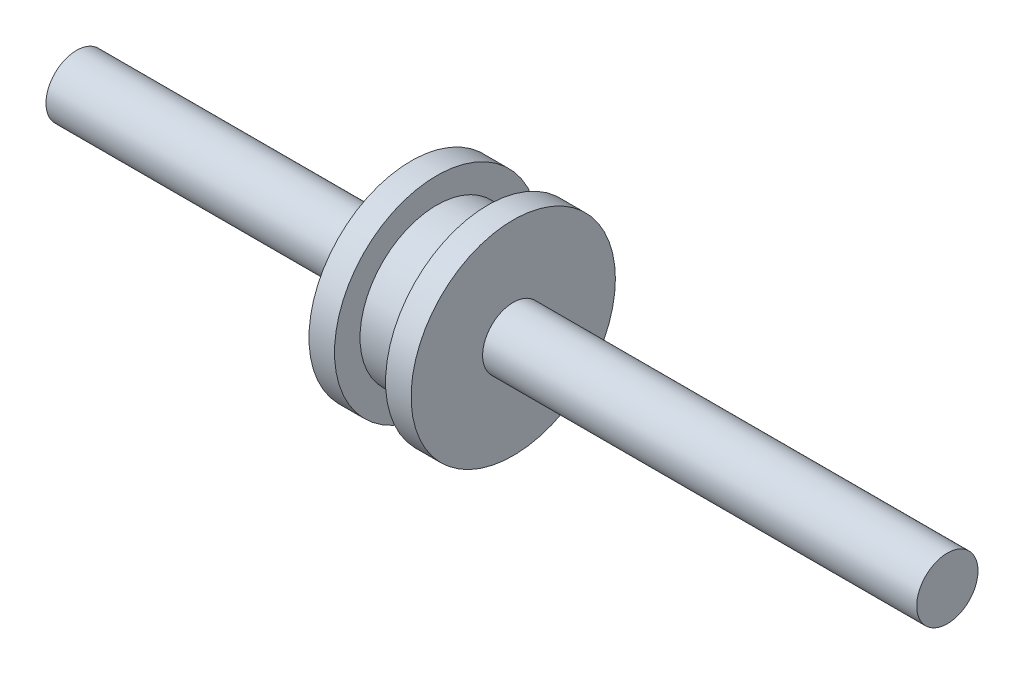
from build123d import *

# Parameters (mm, degrees)
SKETCH1_R           = 6
BOSS_EXTRUDE1_DEPTH = 65.5
SKETCH2_R           = 20
BOSS_EXTRUDE2_DEPTH = 5
SKETCH3_R           = 15
BOSS_EXTRUDE3_DEPTH = 10
SKETCH4_R           = 20
BOSS_EXTRUDE4_DEPTH = 5
SKETCH5_R           = 6
BOSS_EXTRUDE5_DEPTH = 85


with BuildPart() as part:
    # Sketch1 → Boss-Extrude1 (new body)
    with BuildSketch(Plane(origin=(0, 0, 0), x_dir=(0, 0, -1), z_dir=(1, 0, 0))):
        Circle(SKETCH1_R)
    extrude(amount=BOSS_EXTRUDE1_DEPTH)

    # Sketch2 → Boss-Extrude2 (add)
    with BuildSketch(Plane(origin=(65.5, 0, 0), x_dir=(0, 0, -1), z_dir=(1, 0, 0))):
        Circle(SKETCH2_R)
    extrude(amount=BOSS_EXTRUDE2_DEPTH)

    # Sketch3 → Boss-Extrude3 (add)
    with BuildSketch(Plane(origin=(70.5, 0, 0), x_dir=(0, 0, -1), z_dir=(1, 0, 0))):
        Circle(SKETCH3_R)
    extrude(amount=BOSS_EXTRUDE3_DEPTH)

    # Sketch4 → Boss-Extrude4 (add)
    with BuildSketch(Plane(origin=(80.5, 0, 0), x_dir=(0, 0, -1), z_dir=(1, 0, 0))):
        Circle(SKETCH4_R)
    extrude(amount=BOSS_EXTRUDE4_DEPTH)

    # Sketch5 → Boss-Extrude5 (add)
    with BuildSketch(Plane(origin=(85.5, 0, 0), x_dir=(0, 0, -1), z_dir=(1, 0, 0))):
        Circle(SKETCH5_R)
    extrude(amount=BOSS_EXTRUDE5_DEPTH)


solid = part.part
